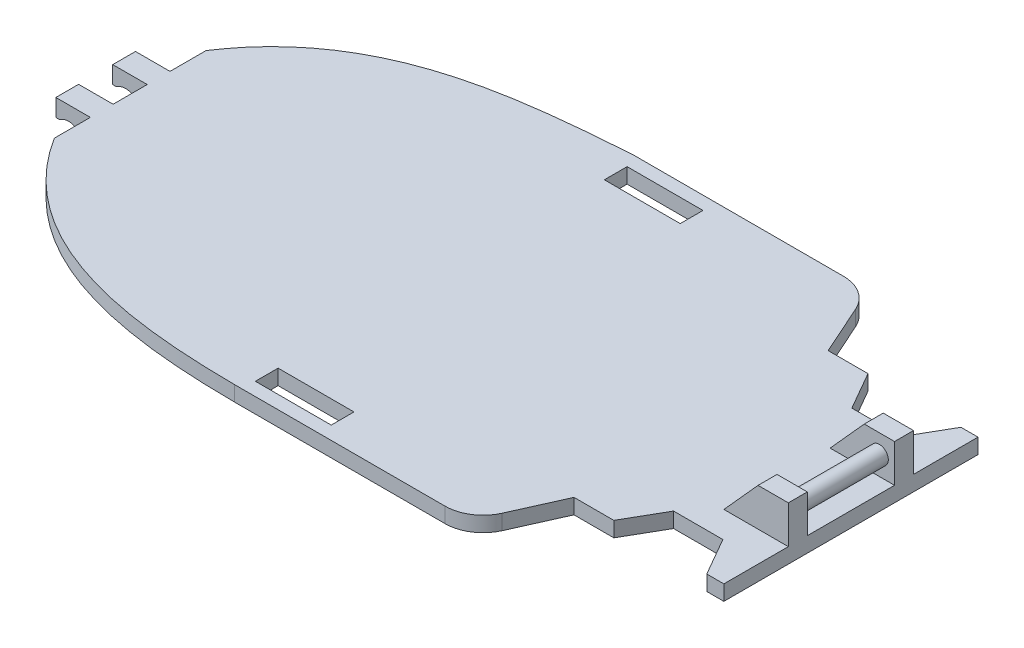
from build123d import *

# Parameters (mm, degrees)
BOSS_EXTRUDE1_DEPTH     = 4
BOSS_EXTRUDE2_START     = -45
BOSS_EXTRUDE2_DEPTH     = 3
BOSS_EXTRUDE3_START     = -39
BOSS_EXTRUDE3_DEPTH     = 3
BOSS_EXTRUDE4_REACH     = 213.107
SKETCH6_R               = 2.5
SKETCH7_W               = 20
SKETCH7_H               = 6
CUT_EXTRUDE1_DEPTH      = 10
CUT_EXTRUDE2_DEPTH      = 228.268563733
FILLET1_R               = 10
CUT_EXTRUDE3_DEPTH      = 228.268563733
SKETCH12_W              = 23
SKETCH12_H              = 10
CUT_EXTRUDE6_DEPTH      = 21
BOSS_EXTRUDE5_REACH     = 213.407
SKETCH13_R              = 2.35
CUT_EXTRUDE7_DEPTH      = 209.214432859
CUT_EXTRUDE7_DEPTH_BACK = 209.214432859
SKETCH15_W              = 6
SKETCH15_H              = 4.56544039
SKETCH15_H_2            = 4.038157292
BOSS_EXTRUDE6_DEPTH     = 1


with BuildPart() as part:
    # Sketch1 → Boss-Extrude1 (new body)
    with BuildSketch(Plane(origin=(0, 0, 0), x_dir=(1, 0, 0), z_dir=(0, 1, 0))):
        with BuildLine():
            Line((-110, 0), (0, 0))
            Line((0, 0), (0, -105))
            Line((0, -105), (-110, -105))
            add(Edge.make_bspline(
                [(-190, -72.5), (-172.262756658, -100.700379519), (-139.265999107, -104.836107107), (-110, -105)],
                knots=[0, 0, 0, 0, 1, 1, 1, 1], degree=3))
            Line((-190, -72.5), (-190, -32.5))
            add(Edge.make_bspline(
                [(-190, -32.5), (-171.707374586, -4.618888995), (-138.989901699, -2.178666842), (-110, 0)],
                knots=[0, 0, 0, 0, 1, 1, 1, 1], degree=3))
        make_face()
    extrude(amount=BOSS_EXTRUDE1_DEPTH)

    # Sketch2 → Boss-Extrude2 (add, symmetric)
    with BuildSketch(Plane.XY.offset(105).offset(BOSS_EXTRUDE2_START)):
        Polygon((-190, 4), (-201, 4), (-201, -11), (-191, -11), (-178, 0), align=None)
    boss_extrude2 = extrude(amount=BOSS_EXTRUDE2_DEPTH, both=True)

    # Mirror1: Boss-Extrude2 across plane
    add(boss_extrude2.mirror(Plane.XY.offset(52.5)))

    # Sketch5 → Boss-Extrude3 (add, symmetric)
    with BuildSketch(Plane.XY.offset(105).offset(BOSS_EXTRUDE3_START)):
        Polygon((-16.979807258, 4), (-7.979807258, 14), (0, 14), (0, 4), align=None)
    boss_extrude3 = extrude(amount=BOSS_EXTRUDE3_DEPTH, both=True)

    # Mirror4: Boss-Extrude3 across plane
    add(boss_extrude3.mirror(Plane.XY.offset(52.5)))

    # Sketch6 → Boss-Extrude4 (add, up to next)
    with BuildSketch(Plane.XY.offset(42), mode=Mode.PRIVATE) as boss_extrude4_sk1:
        with Locations(Location((-4, 10, 0), (0, 0, 180))):
            Circle(SKETCH6_R)
    boss_extrude4_tool1 = extrude(boss_extrude4_sk1.sketch, amount=BOSS_EXTRUDE4_REACH, mode=Mode.PRIVATE) - part.part
    add(boss_extrude4_tool1.solids().sort_by_distance((-4, 10, 42))[0])

    # Sketch7 → Cut-Extrude1 (cut)
    with BuildSketch(Plane(origin=(0, 4, 0), x_dir=(1, 0, 0), z_dir=(0, 1, 0))):
        with Locations((-98, -98.5)):
            Rectangle(SKETCH7_W, SKETCH7_H)
    cut_extrude1 = extrude(amount=-CUT_EXTRUDE1_DEPTH, mode=Mode.SUBTRACT)

    # Mirror5: Cut-Extrude1 across plane
    add(cut_extrude1.mirror(Plane.XY.offset(52.5)), mode=Mode.SUBTRACT)

    # Sketch10 → Cut-Extrude2 (cut, symmetric)
    with BuildSketch(Plane(origin=(0, 4, 0), x_dir=(1, 0, 0), z_dir=(0, 1, 0))):
        Polygon((0, -19), (-39.5, -19), (-48, 0), (0, 0), align=None)
    cut_extrude2 = extrude(amount=CUT_EXTRUDE2_DEPTH, both=True, mode=Mode.SUBTRACT)

    # Mirror6: Cut-Extrude2 across plane
    add(cut_extrude2.mirror(Plane.XY.offset(52.5)), mode=Mode.SUBTRACT)

    # Fillet1
    fillet1_edges = [part.edges().sort_by_distance(p)[0] for p in [
        (-48, 2, 0),
        (-48, 2, 105),
    ]]
    fillet(fillet1_edges, radius=FILLET1_R)

    # Sketch11 → Cut-Extrude3 (cut, symmetric)
    with BuildSketch(Plane(origin=(0, 4, 0), x_dir=(1, 0, 0), z_dir=(0, 1, 0))):
        Polygon((-4.5, -19), (-10.25, -29), (-23.25, -29), (-29, -19), align=None)
    cut_extrude3 = extrude(amount=CUT_EXTRUDE3_DEPTH, both=True, mode=Mode.SUBTRACT)

    # Mirror7: Cut-Extrude3 across plane
    add(cut_extrude3.mirror(Plane.XY.offset(52.5)), mode=Mode.SUBTRACT)

    # Sketch12 → Cut-Extrude6 (cut)
    with BuildSketch(Plane(origin=(0, 0, 0), x_dir=(0, 0, -1), z_dir=(1, 0, 0))):
        with Locations((-52.5, 9)):
            Rectangle(SKETCH12_W, SKETCH12_H)
    extrude(amount=-CUT_EXTRUDE6_DEPTH, mode=Mode.SUBTRACT)

    # Sketch13 → Boss-Extrude5 (add, up to next)
    with BuildSketch(Plane(origin=(0, 0, 64), x_dir=(-1, 0, 0), z_dir=(0, 0, -1)), mode=Mode.PRIVATE) as boss_extrude5_sk1:
        with Locations(Location((3.989903629, 9, 0), (0, 0, 180))):
            Circle(SKETCH13_R)
    boss_extrude5_tool1 = extrude(boss_extrude5_sk1.sketch, amount=BOSS_EXTRUDE5_REACH, mode=Mode.PRIVATE) - part.part
    add(boss_extrude5_tool1.solids().sort_by_distance((-3.989904, 9, 64))[0])

    # Sketch14 → Cut-Extrude7 (cut, two sides: drawn at the far end of the back side and taken through both)
    with BuildSketch(Plane.XY.offset(52.5).offset(-CUT_EXTRUDE7_DEPTH_BACK)):
        with BuildLine():
            Line((-198.09573372, 4), (-198.09573372, -0.56544039))
            ThreePointArc((-198.09573372, -0.56544039), (-191.693337136, -3.763641549), (-198.09573372, -6.961842708))
            Line((-198.09573372, -6.961842708), (-198.09573372, -11))
            Line((-198.09573372, -11), (-202.719197906, -12.115187625))
            Line((-202.719197906, -12.115187625), (-202.588499271, 4.842960165))
            Line((-202.588499271, 4.842960165), (-198.09573372, 4))
        make_face()
    extrude(amount=CUT_EXTRUDE7_DEPTH + CUT_EXTRUDE7_DEPTH_BACK, mode=Mode.SUBTRACT)

    # Sketch15 → Boss-Extrude6 (add)
    with BuildSketch(Plane.ZY.offset(198.09573372)):
        with Locations((60, 1.717279805)):
            Rectangle(SKETCH15_W, SKETCH15_H)
        with Locations((45, 1.717279805)):
            Rectangle(SKETCH15_W, SKETCH15_H)
        with Locations((45, -8.980921354)):
            Rectangle(SKETCH15_W, SKETCH15_H_2)
        with Locations((60, -8.980921354)):
            Rectangle(SKETCH15_W, SKETCH15_H_2)
    extrude(amount=BOSS_EXTRUDE6_DEPTH)


solid = part.part
